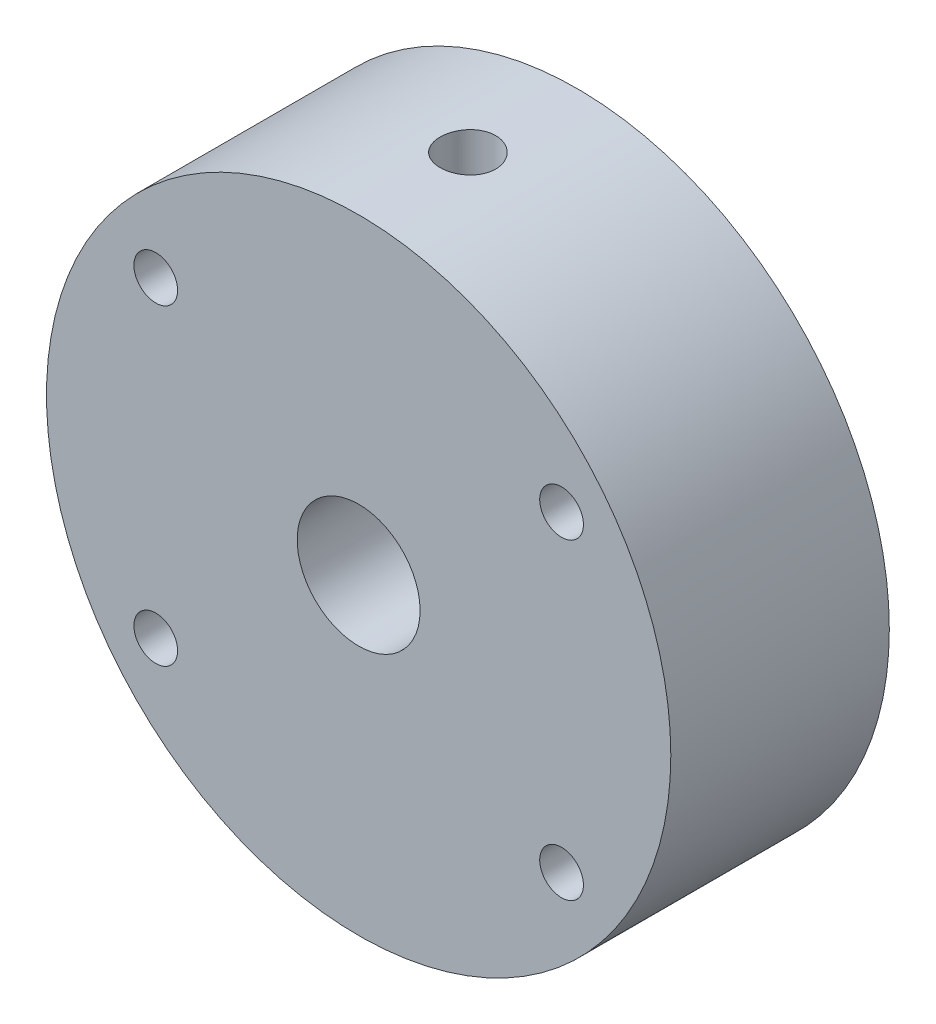
from build123d import *

# Parameters (mm, degrees)
SKETCH1_R             = 12.7
SKETCH1_R_2           = 2.5
BOSS_EXTRUDE1_DEPTH   = 8.89
F_2_56_TAPPED_HOLE1_D = 1.778
SKETCH6_W             = 1.1303
SKETCH6_H             = 12.7


with BuildPart() as part:
    # Sketch1 → Boss-Extrude1 (new body)
    with BuildSketch(Plane.XY):
        Circle(SKETCH1_R)
        Circle(SKETCH1_R_2, mode=Mode.SUBTRACT)
    extrude(amount=BOSS_EXTRUDE1_DEPTH)

    # #2-56 Tapped Hole1 (through all)
    with Locations(Plane.XY.offset(8.89)):
        with Locations((-8.255, 6.35), (8.255, 6.35), (8.255, -6.35), (-8.255, -6.35)):
            Hole(F_2_56_TAPPED_HOLE1_D / 2)

    # Sketch6 → #4-40 Tapped Hole1 (revolve, cut)
    with BuildSketch(Plane(origin=(0, 0, 4.445), x_dir=(0, 0, -1), z_dir=(1, 0, 0))):
        with Locations((0.56515, 6.35)):
            Rectangle(SKETCH6_W, SKETCH6_H)
    revolve(axis=Axis((0, -6.35, 4.445), (0, 1, 0)), mode=Mode.SUBTRACT)


solid = part.part
